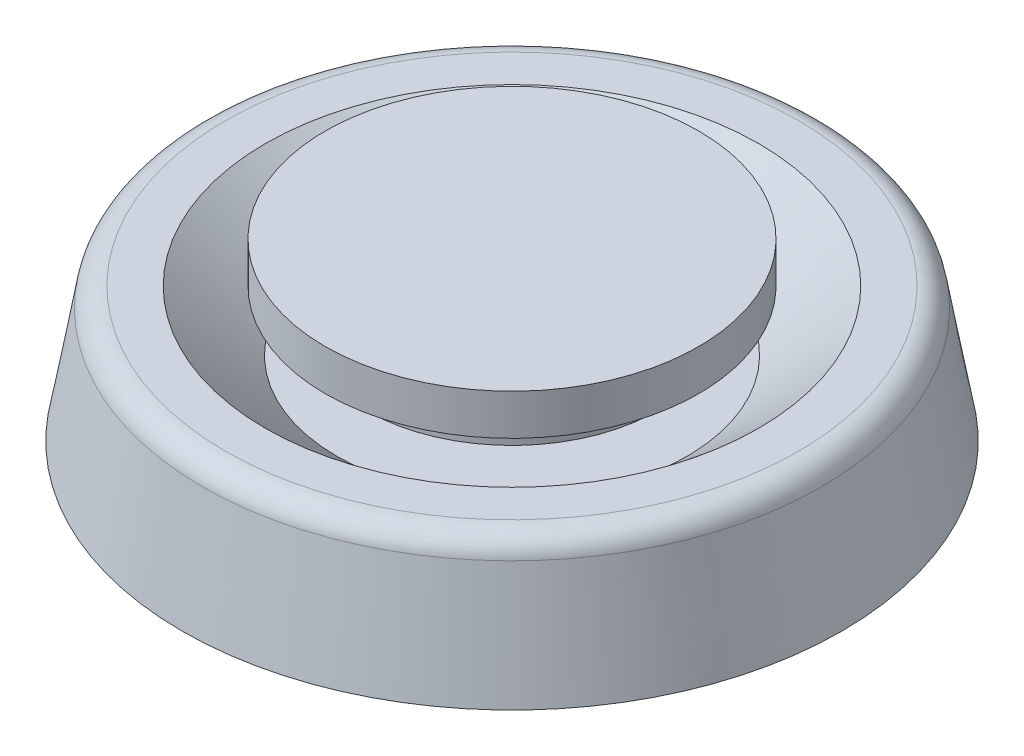
from build123d import *


with BuildPart() as part:
    # Sketch1 → Revolve1 (revolve)
    with BuildSketch(Plane.XY, mode=Mode.PRIVATE) as revolve1_sk:
        with BuildLine():
            Line((0, 0), (0, 15))
            Line((0, 15), (-16, 15))
            Line((-16, 15), (-16, 11.5))
            Line((-16, 11.5), (-12.5, 11.5))
            Line((-12.5, 11.5), (-12.5, 8.5))
            Line((-12.5, 8.5), (-7.5, 8.5))
            Line((-7.5, 8.5), (-7.5, 6.35483871))
            Line((-7.5, 6.35483871), (-15, 6.35483871))
            Line((-15, 6.35483871), (-21.131764452, 11.5))
            Line((-21.131764452, 11.5), (-24.544040459, 11.5))
            ThreePointArc((-24.544040459, 11.5), (-25.829615679, 11.032088886), (-26.513655966, 9.847296355))
            Line((-26.513655966, 9.847296355), (-28.25, 0))
            Line((-28.25, 0), (0, 0))
        make_face()
    revolve(revolve1_sk.sketch.rotate(Axis((0, 0, 0), (0, -1, 0)), 270), axis=Axis((0, 0, 0), (0, -1, 0)))


solid = part.part
